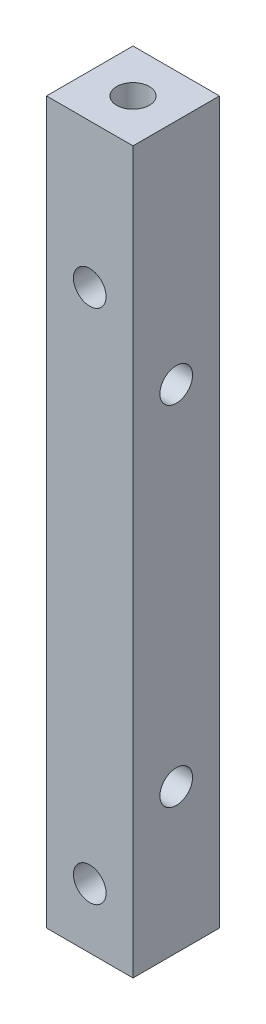
from build123d import *

# Parameters (mm, degrees)
SKETCH1_W                     = 9.144
SKETCH1_H                     = 9.144
BOSS_EXTRUDE1_DEPTH           = 76.2
TAP_DRILL_FOR_8_32_TAP1_D     = 3.4544
TAP_DRILL_FOR_8_32_TAP2_D     = 3.4544
TAP_DRILL_FOR_8_32_TAP3_D     = 3.4544
TAP_DRILL_FOR_8_32_TAP3_DEPTH = 7.62
TAP_DRILL_FOR_8_32_TAP3_TIP   = 1.037806461


with BuildPart() as part:
    # Sketch1 → Boss-Extrude1 (new body)
    with BuildSketch(Plane(origin=(0, 0, 0), x_dir=(1, 0, 0), z_dir=(0, 1, 0))):
        Rectangle(SKETCH1_W, SKETCH1_H)
    extrude(amount=BOSS_EXTRUDE1_DEPTH)

    # Tap Drill for #8-32 Tap1 (through all)
    with Locations(Plane.XY.offset(4.572)):
        with Locations((0, 60.96), (0, 6.35)):
            Hole(TAP_DRILL_FOR_8_32_TAP1_D / 2)

    # Tap Drill for #8-32 Tap2 (through all)
    with Locations(Plane(origin=(4.572, 0, 0), x_dir=(0, 0, -1), z_dir=(1, 0, 0))):
        with Locations((0, 52.07), (0, 15.24)):
            Hole(TAP_DRILL_FOR_8_32_TAP2_D / 2)

    # Tap Drill for #8-32 Tap3
    with Locations(Plane(origin=(0, 76.2, 0), x_dir=(1, 0, 0), z_dir=(0, 1, 0))):
        with Locations((0, 0)):
            Hole(TAP_DRILL_FOR_8_32_TAP3_D / 2, depth=TAP_DRILL_FOR_8_32_TAP3_DEPTH)
            with Locations((0, 0, -(TAP_DRILL_FOR_8_32_TAP3_DEPTH + TAP_DRILL_FOR_8_32_TAP3_TIP / 2))):  # 118° drill point
                Cone(0, TAP_DRILL_FOR_8_32_TAP3_D / 2, TAP_DRILL_FOR_8_32_TAP3_TIP, mode=Mode.SUBTRACT)


solid = part.part
